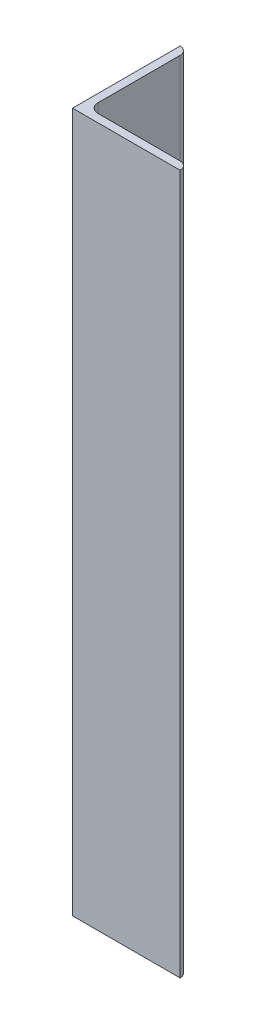
from build123d import *

# Parameters (mm, degrees)
IRON_V40X40X3_1_DEPTH = 260
CUT_EXTRUDE1_DEPTH    = 10


with BuildPart() as part:
    # Sketch1 → Iron V40X40X3(1) (new body)
    with BuildSketch(Plane(origin=(0, 0, 0), x_dir=(1, 0, 0), z_dir=(0, 1, 0))):
        with BuildLine():
            Line((0, 0), (0, 40))
            ThreePointArc((0, 40), (2.121320344, 39.121320344), (3, 37))
            Line((3, 37), (3, 6.5))
            ThreePointArc((3, 6.5), (4.025126266, 4.025126266), (6.5, 3))
            Line((6.5, 3), (37, 3))
            ThreePointArc((37, 3), (39.121320344, 2.121320344), (40, 0))
            Line((40, 0), (0, 0))
        make_face()
    extrude(amount=IRON_V40X40X3_1_DEPTH)

    # Sketch2 → Cut-Extrude1 (cut)
    with BuildSketch(Plane(origin=(0, 0, 0), x_dir=(0, 0, -1), z_dir=(1, 0, 0))):
        with BuildLine():
            Line((10.5, 55), (25.5, 55))
            ThreePointArc((25.5, 55), (30.5, 50), (25.5, 45))
            Line((25.5, 45), (10.5, 45))
            ThreePointArc((10.5, 45), (5.5, 50), (10.5, 55))
        make_face()
        with BuildLine():
            Line((10.5, 85), (25.5, 85))
            ThreePointArc((25.5, 85), (30.5, 80), (25.5, 75))
            Line((25.5, 75), (10.5, 75))
            ThreePointArc((10.5, 75), (5.5, 80), (10.5, 85))
        make_face()
    extrude(amount=CUT_EXTRUDE1_DEPTH, mode=Mode.SUBTRACT)


solid = part.part
